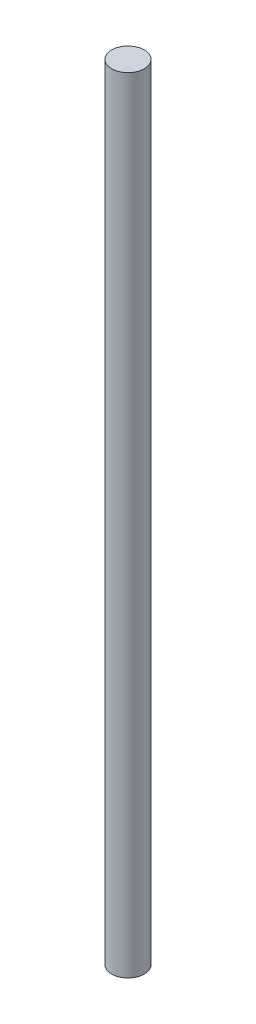
from build123d import *

# Parameters (mm, degrees)
SKETCH1_R           = 0.5
BOSS_EXTRUDE1_DEPTH = 24


with BuildPart() as part:
    # Sketch1 → Boss-Extrude1 (new body)
    with BuildSketch(Plane(origin=(0, 0, 0), x_dir=(1, 0, 0), z_dir=(0, 1, 0))):
        with Locations(Location((0, 0, 0), (0, 0, 270))):
            Circle(SKETCH1_R)
    extrude(amount=BOSS_EXTRUDE1_DEPTH)


solid = part.part
